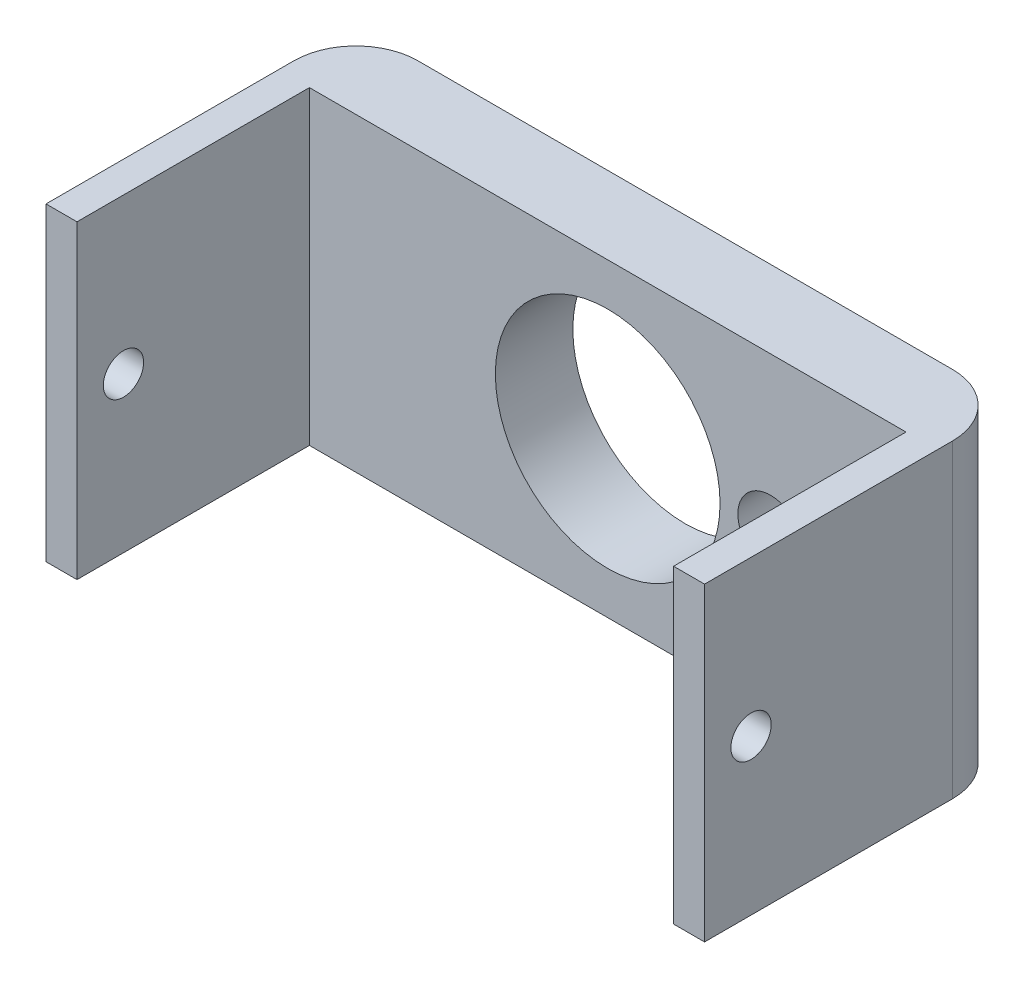
from build123d import *

# Parameters (mm, degrees)
SKETCH_1_W          = 42.5
SKETCH_1_H          = 20
EXTRUDE_1_DEPTH     = 20
SKETCH_2_W          = 38.5
SKETCH_2_H          = 20
CUT_EXTRUDE_1_DEPTH = 15
SKETCH_3_R          = 7.25
CUT_EXTRUDE_2_DEPTH = 5
CUT_EXTRUDE_3_REACH = 50.023
SKETCH_4_R          = 1.3
SKETCH_5_R          = 2.1
CUT_EXTRUDE_4_DEPTH = 5
FILLET_1_R          = 4


with BuildPart() as part:
    # 草图1 → 凸台-拉伸1 (new body)
    with BuildSketch(Plane.XY):
        Rectangle(SKETCH_1_W, SKETCH_1_H)
    extrude(amount=EXTRUDE_1_DEPTH)

    # 草图2 → 切除-拉伸1 (cut)
    with BuildSketch(Plane.XY.offset(20)):
        Rectangle(SKETCH_2_W, SKETCH_2_H)
    extrude(amount=-CUT_EXTRUDE_1_DEPTH, mode=Mode.SUBTRACT)

    # 草图3 → 切除-拉伸2 (cut)
    with BuildSketch(Plane(origin=(0, 0, 0), x_dir=(-1, 0, 0), z_dir=(0, 0, -1))):
        Circle(SKETCH_3_R)
    extrude(amount=-CUT_EXTRUDE_2_DEPTH, mode=Mode.SUBTRACT)

    # 切除-拉伸3: up to this face of the body (flat: up to its plane)
    cut_extrude_3_end = Plane(part.part.faces().sort_by_distance((-21.25, 0, 10))[0])
    # 草图4 → 切除-拉伸3 (cut, up to the picked face)
    with BuildSketch(Plane(origin=(21.25, 0, 0), x_dir=(0, 0, -1), z_dir=(1, 0, 0)), mode=Mode.PRIVATE) as cut_extrude_3_sk1:
        with Locations((-17, 0)):
            Circle(SKETCH_4_R)
    cut_extrude_3_tool1 = split(extrude(cut_extrude_3_sk1.sketch, amount=-CUT_EXTRUDE_3_REACH, mode=Mode.PRIVATE), bisect_by=cut_extrude_3_end, keep=Keep.BOTH, mode=Mode.PRIVATE)
    add(cut_extrude_3_tool1.solids().sort_by(Axis((21.25, 0, 17), (-1, 0, 0)))[0], mode=Mode.SUBTRACT)

    # 草图5 → 切除-拉伸4 (cut)
    with BuildSketch(Plane(origin=(0, 0, 0), x_dir=(-1, 0, 0), z_dir=(0, 0, -1))):
        with Locations((-10.5, 0)):
            Circle(SKETCH_5_R)
    extrude(amount=-CUT_EXTRUDE_4_DEPTH, mode=Mode.SUBTRACT)

    # 圆角1
    fillet_1_edges = [part.edges().sort_by_distance(p)[0] for p in [
        (-21.25, 0, 0),
        (21.25, 0, 0),
    ]]
    fillet(fillet_1_edges, radius=FILLET_1_R)


solid = part.part
